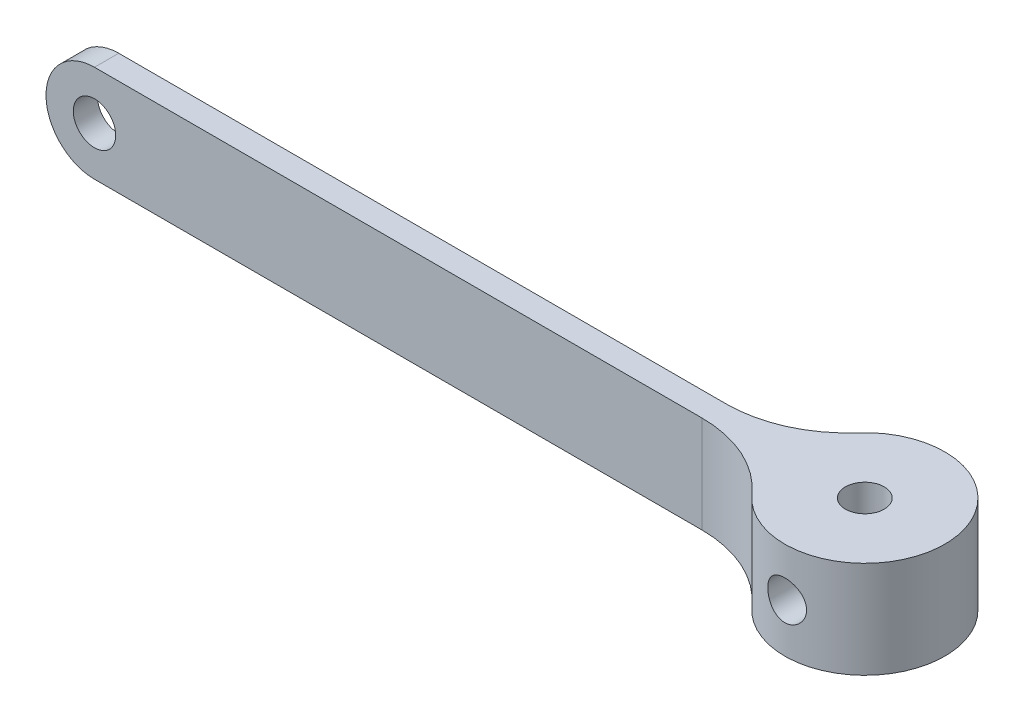
from build123d import *

# Parameters (mm, degrees)
SKETCH1_R               = 1.6
BOSS_EXTRUDE1_DEPTH     = 8
CUT_EXTRUDE1_DEPTH      = 68.432753975
CUT_EXTRUDE1_DEPTH_BACK = 68.432753975
SKETCH2_R               = 1.75
SKETCH2_R_2             = 1.6
FILLET1_R               = 10


with BuildPart() as part:
    # Sketch1 → Boss-Extrude1 (new body)
    with BuildSketch(Plane(origin=(0, 0, 0), x_dir=(1, 0, 0), z_dir=(0, 1, 0))):
        with BuildLine():
            Line((-6.523802572, 1), (-66.523802572, 1))
            Line((-66.523802572, 1), (-66.523802572, -1))
            Line((-66.523802572, -1), (-6.523802572, -1))
            ThreePointArc((-6.523802572, -1), (0, -6.6), (6.523802572, -1))
            ThreePointArc((6.523802572, -1), (6.6, 0), (6.523802572, 1))
            ThreePointArc((6.523802572, 1), (0, 6.6), (-6.523802572, 1))
        make_face()
        with Locations(Location((0, 0, 0), (0, 0, 270))):
            Circle(SKETCH1_R, mode=Mode.SUBTRACT)
    extrude(amount=BOSS_EXTRUDE1_DEPTH)

    # Sketch2 → Cut-Extrude1 (cut, two sides: drawn at the far end of the back side and taken through both)
    with BuildSketch(Plane.XY.offset(1).offset(-CUT_EXTRUDE1_DEPTH_BACK)):
        with BuildLine():
            Line((-66.523802572, 8), (-66.523802572, 4))
            ThreePointArc((-66.523802572, 4), (-65.352229697, 6.828427125), (-62.523802572, 8))
            Line((-62.523802572, 8), (-66.523802572, 8))
        make_face()
        with BuildLine():
            Line((-66.523802572, 4), (-66.523802572, 0))
            Line((-66.523802572, 0), (-62.523802572, 0))
            ThreePointArc((-62.523802572, 0), (-65.352229697, 1.171572875), (-66.523802572, 4))
        make_face()
        with Locations((-62.523802572, 4)):
            Circle(SKETCH2_R)
        with Locations((0, 4)):
            Circle(SKETCH2_R_2)
    extrude(amount=CUT_EXTRUDE1_DEPTH + CUT_EXTRUDE1_DEPTH_BACK, mode=Mode.SUBTRACT)

    # Fillet1
    fillet1_edges = [part.edges().sort_by_distance(p)[0] for p in [
        (-6.523802572, 4, 1),
        (-6.523802572, 4, -1),
    ]]
    fillet(fillet1_edges, radius=FILLET1_R)


solid = part.part
